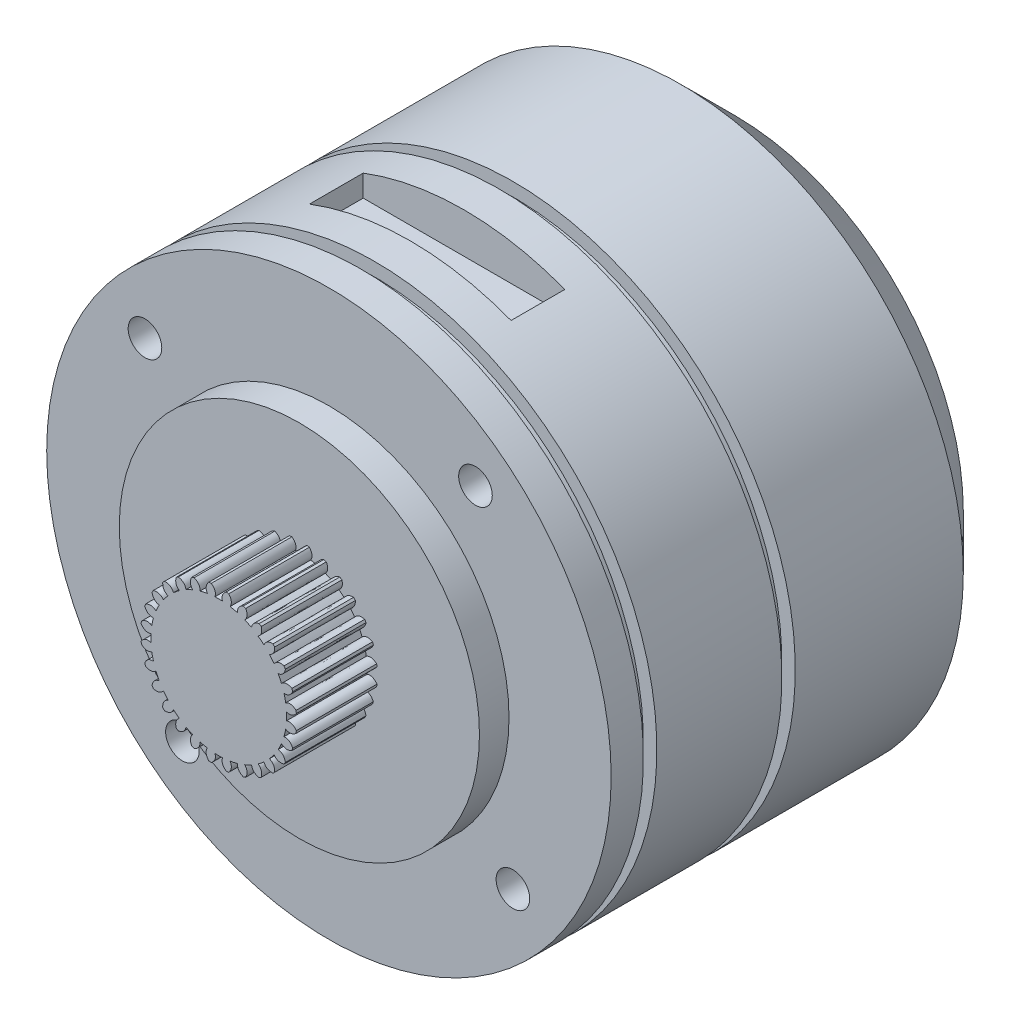
from build123d import *

# Parameters (mm, degrees)
SKETCH_1_R                = 21
EXTRUDE_1_DEPTH           = 66.7
CHAMFER_1_SIZE            = 4
SKETCH_6_R                = 13
EXTRUDE_2_DEPTH           = 2
EXTRUDE_3_DEPTH           = 25.3
EXTRUDE_3_DEPTH_BACK      = 73.1
SKETCH_7_R                = 3.75
SKETCH_8_R                = 1.5
CUT_EXTRUDE_3_DEPTH       = 12.65
HOLE_WIZARD_M5_1_D        = 4.2
HOLE_WIZARD_M5_1_DEPTH    = 13
HOLE_WIZARD_M5_1_TIP      = 1.2618073
HOLE_WIZARD_M4_1_D        = 3.3
HOLE_WIZARD_M4_1_DEPTH    = 10
HOLE_WIZARD_M4_1_TIP      = 0.991420021
SKETCH_14_R               = 22.258328558
SKETCH_14_R_2             = 20
CUT_EXTRUDE_5_DEPTH       = 0.5
SKETCH_15_R               = 23.037922248
SKETCH_15_R_2             = 20
CUT_EXTRUDE_6_DEPTH       = 0.5
SKETCH_16_W               = 15
SKETCH_16_H               = 4
CUT_EXTRUDE_7_DEPTH       = 7
CUT_EXTRUDE_8_DEPTH       = 20
SKETCH_18_R               = 12
SKETCH_18_R_2             = 11
CUT_EXTRUDE_9_DEPTH       = 2
SKETCH_19_R               = 11.587392296
CUT_EXTRUDE_10_DEPTH      = 2
CUT_EXTRUDE_11_DEPTH      = 2
CUT_EXTRUDE_12_DEPTH      = 42
CUT_EXTRUDE_12_DEPTH_BACK = 44
SKETCH_22_W               = 57.620892655
SKETCH_22_H               = 70.84896664
PATTERN_CIRCULAR_3_COUNT  = 4
SKETCH_27_R               = 13.4
EXTRUDE_4_DEPTH           = 2.2
SKETCH_30_R               = 5.8
EXTRUDE_5_DEPTH           = 6
HOLE_WIZARD_M3_3_D        = 2.5
HOLE_WIZARD_M3_3_DEPTH    = 7
HOLE_WIZARD_M3_3_TIP      = 0.751075774
CUT_EXTRUDE_START         = -6
CUT_EXTRUDE_13_DEPTH      = 6
PATTERN_CIRCULAR_4_COUNT  = 28


with BuildPart() as part:
    # 草图1 → 凸台-拉伸1 (new body)
    with BuildSketch(Plane.XY):
        Circle(SKETCH_1_R)
    extrude(amount=EXTRUDE_1_DEPTH)

    # 倒角1
    chamfer_1_edges = [part.edges().sort_by_distance(p)[0] for p in [
        (-21, 0, 0),
    ]]
    chamfer(chamfer_1_edges, length=CHAMFER_1_SIZE)

    # 草图6 → 凸台-拉伸2 (add)
    with BuildSketch(Plane.XY.offset(66.7)):
        Circle(SKETCH_6_R)
    extrude(amount=EXTRUDE_2_DEPTH)

    # 草图7 → 凸台-拉伸3 (add, two sides: drawn at the far end of the back side and taken through both)
    with BuildSketch(Plane.XY.offset(68.7).offset(-EXTRUDE_3_DEPTH_BACK)):
        Circle(SKETCH_7_R)
    extrude(amount=EXTRUDE_3_DEPTH + EXTRUDE_3_DEPTH_BACK)

    # 草图8 → 切除-拉伸3 (cut, symmetric)
    with BuildSketch(Plane(origin=(0, 0, 0), x_dir=(1, 0, 0), z_dir=(0, 1, 0))):
        with Locations(Location((0, -84, 0), (0, 0, 270))):
            Circle(SKETCH_8_R)
    extrude(amount=CUT_EXTRUDE_3_DEPTH, both=True, mode=Mode.SUBTRACT)

    # M5 螺纹孔的螺纹孔钻头1
    with Locations(Plane.XY.offset(94)):
        with Locations((0, 0)):
            Hole(HOLE_WIZARD_M5_1_D / 2, depth=HOLE_WIZARD_M5_1_DEPTH)
            with Locations((0, 0, -(HOLE_WIZARD_M5_1_DEPTH + HOLE_WIZARD_M5_1_TIP / 2))):  # 118° drill point
                Cone(0, HOLE_WIZARD_M5_1_D / 2, HOLE_WIZARD_M5_1_TIP, mode=Mode.SUBTRACT)

    # M4 螺纹孔的螺纹孔钻头1
    with Locations(Plane(origin=(0, 17.5, 66.7), x_dir=(1, 0, 0), z_dir=(0, 0, 1))):
        with Locations((0, 0), (-17.5, -17.5), (17.5, -17.5), (0, -35)):
            Hole(HOLE_WIZARD_M4_1_D / 2, depth=HOLE_WIZARD_M4_1_DEPTH)
            with Locations((0, 0, -(HOLE_WIZARD_M4_1_DEPTH + HOLE_WIZARD_M4_1_TIP / 2))):  # 118° drill point
                Cone(0, HOLE_WIZARD_M4_1_D / 2, HOLE_WIZARD_M4_1_TIP, mode=Mode.SUBTRACT)

    # 草图14 → 切除-拉伸5 (cut, symmetric)
    with BuildSketch(Plane(origin=(0, 0, 27.3), x_dir=(-1, 0, 0), z_dir=(0, 0, -1))):
        Circle(SKETCH_14_R)
        Circle(SKETCH_14_R_2, mode=Mode.SUBTRACT)
    extrude(amount=CUT_EXTRUDE_5_DEPTH, both=True, mode=Mode.SUBTRACT)

    # 草图15 → 切除-拉伸6 (cut, symmetric)
    with BuildSketch(Plane(origin=(0, 0, 17), x_dir=(-1, 0, 0), z_dir=(0, 0, -1))):
        Circle(SKETCH_15_R)
        Circle(SKETCH_15_R_2, mode=Mode.SUBTRACT)
    extrude(amount=CUT_EXTRUDE_6_DEPTH, both=True, mode=Mode.SUBTRACT)

    # 草图16 → 切除-拉伸7 (cut)
    with BuildSketch(Plane(origin=(0, 25, 0), x_dir=(1, 0, 0), z_dir=(0, 1, 0))):
        with Locations((0, -22.15)):
            Rectangle(SKETCH_16_W, SKETCH_16_H)
    extrude(amount=-CUT_EXTRUDE_7_DEPTH, mode=Mode.SUBTRACT)

    # 草图17 → 切除-拉伸8 (cut)
    with BuildSketch(Plane.XY.offset(94)):
        with BuildLine():
            Line((-2.144650443, 3.076194805), (2.144650443, 3.076194805))
            ThreePointArc((2.144650443, 3.076194805), (0, 3.75), (-2.144650443, 3.076194805))
        make_face()
    extrude(amount=-CUT_EXTRUDE_8_DEPTH, mode=Mode.SUBTRACT)

    # 草图18 → 切除-拉伸9 (cut)
    with BuildSketch(Plane.XY.offset(68.7)):
        Circle(SKETCH_18_R)
        Circle(SKETCH_18_R_2, mode=Mode.SUBTRACT)
    extrude(amount=-CUT_EXTRUDE_9_DEPTH, mode=Mode.SUBTRACT)

    # 草图19 → 切除-拉伸10 (cut)
    with BuildSketch(Plane.XY.offset(68.7)):
        Circle(SKETCH_19_R)
        with BuildLine():
            ThreePointArc((6.791623727, -5.370647994), (0, 8.658522548), (-6.791623727, -5.370647994))
            add(Edge.make_bspline(
                [(-3.504698918, -2.27732653), (-1.635312829, -8.769229196), (-6.791623727, -5.370647994)],
                knots=[0, 0, 0, 1, 1, 1], degree=2))
            ThreePointArc((-3.504698918, -2.27732653), (0, -4.179608909), (3.504698918, -2.27732653))
            add(Edge.make_bspline(
                [(3.504698918, -2.27732653), (1.635312829, -8.769229196), (6.791623727, -5.370647994)],
                knots=[0, 0, 0, 1, 1, 1], degree=2))
        make_face(mode=Mode.SUBTRACT)
    extrude(amount=-CUT_EXTRUDE_10_DEPTH, mode=Mode.SUBTRACT)

    # 草图20 → 切除-拉伸11 (cut)
    with BuildSketch(Plane.XY.offset(68.7)):
        with BuildLine():
            Line((-6.063806811, 1.351241382), (-5.324669611, 4.123005885))
            ThreePointArc((-5.324669611, 4.123005885), (-4.246633403, 4.74713211), (-3.622507178, 3.669095902))
            Line((-3.622507178, 3.669095902), (-4.361644379, 0.8973314))
            ThreePointArc((-4.361644379, 0.8973314), (-5.439680586, 0.273205175), (-6.063806811, 1.351241382))
        make_face()
        with BuildLine():
            Line((6.063806811, 1.351241382), (5.324669611, 4.123005885))
            ThreePointArc((5.324669611, 4.123005885), (4.246633403, 4.74713211), (3.622507178, 3.669095902))
            Line((3.622507178, 3.669095902), (4.361644379, 0.8973314))
            ThreePointArc((4.361644379, 0.8973314), (5.439680586, 0.273205175), (6.063806811, 1.351241382))
        make_face()
    extrude(amount=-CUT_EXTRUDE_11_DEPTH, mode=Mode.SUBTRACT)

    # 草图22 → 切除-拉伸12 (cut, two sides: drawn at the far end of the back side and taken through both)
    with BuildSketch(Plane(origin=(0, 0, 0), x_dir=(1, 0, 0), z_dir=(0, 1, 0)).offset(-CUT_EXTRUDE_12_DEPTH_BACK)):
        with Locations((-0.403507652, -65.62448332)):
            Rectangle(SKETCH_22_W, SKETCH_22_H)
    extrude(amount=CUT_EXTRUDE_12_DEPTH + CUT_EXTRUDE_12_DEPTH_BACK, mode=Mode.SUBTRACT)

    # 草图26 → M3 螺纹孔2 (revolve, cut)
    with BuildSketch(Plane(origin=(10.903107063, 13.688398605, 30.2), x_dir=(0, -1, 0), z_dir=(1, 0, 0))):
        Polygon((0, 0), (0, 8.751075774), (1.25, 8), (1.25, 0), align=None)
    hole_wizard_m3_2 = revolve(axis=Axis((10.903107063, 13.688398605, 36.55), (0, 0, -1)), mode=Mode.SUBTRACT)

    # 阵列(圆周)3: M3 螺纹孔2 ×4 about axis
    pattern_circular_3_axis = Axis((0, 0, 0), (0, 0, 1))
    for i in range(1, PATTERN_CIRCULAR_3_COUNT):
        add(hole_wizard_m3_2.rotate(pattern_circular_3_axis, i * 360 / PATTERN_CIRCULAR_3_COUNT), mode=Mode.SUBTRACT)

    # 草图27 → 凸台-拉伸4 (add)
    with BuildSketch(Plane.XY.offset(30.2)):
        Circle(SKETCH_27_R)
    extrude(amount=EXTRUDE_4_DEPTH)

    # 草图30 → 凸台-拉伸5 (add)
    with BuildSketch(Plane.XY.offset(32.4)):
        Circle(SKETCH_30_R)
    extrude(amount=EXTRUDE_5_DEPTH)

    # M3 螺纹孔3
    with Locations(Plane(origin=(-6.5, 0, 0), x_dir=(-1, 0, 0), z_dir=(0, 0, -1))):
        with Locations((0, 0), (-13, 0)):
            Hole(HOLE_WIZARD_M3_3_D / 2, depth=HOLE_WIZARD_M3_3_DEPTH)
            with Locations((0, 0, -(HOLE_WIZARD_M3_3_DEPTH + HOLE_WIZARD_M3_3_TIP / 2))):  # 118° drill point
                Cone(0, HOLE_WIZARD_M3_3_D / 2, HOLE_WIZARD_M3_3_TIP, mode=Mode.SUBTRACT)

    # 草图34 → 切除-拉伸13 (cut)
    with BuildSketch(Plane.XY.offset(38.4).offset(CUT_EXTRUDE_START)):
        with BuildLine():
            ThreePointArc((0.28218892, 5.044782588), (0, 5.052668795), (-0.28218892, 5.044782588))
            add(Edge.make_bspline(
                [(-0.28218892, 5.044782588), (-0.1457912, 5.46887513), (-0.554427441, 5.773440067)],
                knots=[0, 0, 0, 1, 1, 1], degree=2))
            ThreePointArc((-0.554427441, 5.773440067), (0, 5.8), (0.554427441, 5.773440067))
            add(Edge.make_bspline(
                [(0.28218892, 5.044782588), (0.1457912, 5.46887513), (0.554427441, 5.773440067)],
                knots=[0, 0, 0, 1, 1, 1], degree=2))
        make_face()
    cut_extrude_13 = extrude(amount=CUT_EXTRUDE_13_DEPTH, mode=Mode.SUBTRACT)

    # 阵列(圆周)4: 切除-拉伸13 ×28 about axis
    pattern_circular_4_axis = Axis((0, 0, 66.7), (0, 0, -1))
    for i in range(1, PATTERN_CIRCULAR_4_COUNT):
        add(cut_extrude_13.rotate(pattern_circular_4_axis, i * 360 / PATTERN_CIRCULAR_4_COUNT), mode=Mode.SUBTRACT)


solid = part.part
